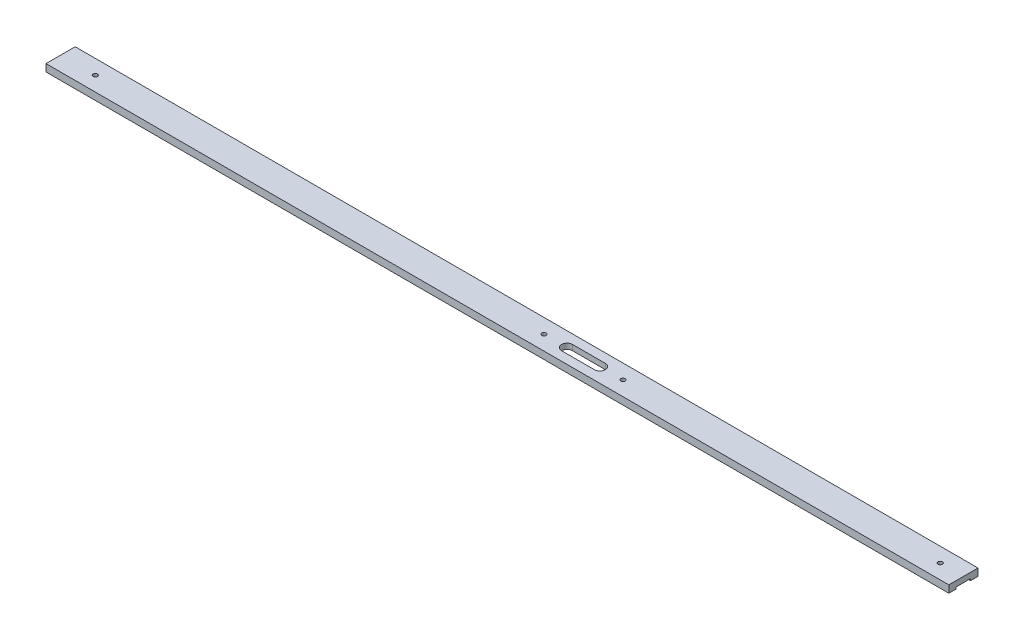
from build123d import *

# Parameters (mm, degrees)
SKETCH1_W                 = 247.65
SKETCH1_H                 = 8
BOSS_EXTRUDE1_DEPTH       = 2
SKETCH2_W                 = 4
SKETCH2_H                 = 1
CUT_EXTRUDE1_DEPTH        = 248.690376277
CUT_EXTRUDE2_DEPTH        = 124.898670796
F_0_80_TAPPED_HOLE1_D     = 1.19126
F_0_80_TAPPED_HOLE1_DEPTH = 4.572
F_0_80_TAPPED_HOLE1_TIP   = 0.357890611


with BuildPart() as part:
    # Sketch1 → Boss-Extrude1 (new body)
    with BuildSketch(Plane(origin=(0, 0, 0), x_dir=(1, 0, 0), z_dir=(0, 1, 0))):
        Rectangle(SKETCH1_W, SKETCH1_H)
    extrude(amount=BOSS_EXTRUDE1_DEPTH)

    # Sketch2 → Cut-Extrude1 (cut, through all)
    with BuildSketch(Plane(origin=(123.825, 0, 0), x_dir=(0, 0, -1), z_dir=(1, 0, 0))):
        Rectangle(SKETCH2_W, SKETCH2_H)
    extrude(amount=-CUT_EXTRUDE1_DEPTH, mode=Mode.SUBTRACT)

    # Sketch5 → Cut-Extrude2 (cut, through all)
    with BuildSketch(Plane(origin=(0, 0.5, 0), x_dir=(-1, 0, 0), z_dir=(0, 1, 0))):
        with BuildLine():
            Line((-15.1088, -1.5), (-24.1088, -1.5))
            ThreePointArc((-24.1088, -1.5), (-25.6088, 0), (-24.1088, 1.5))
            Line((-24.1088, 1.5), (-15.1088, 1.5))
            ThreePointArc((-15.1088, 1.5), (-13.6088, 0), (-15.1088, -1.5))
        make_face()
    extrude(amount=CUT_EXTRUDE2_DEPTH, mode=Mode.SUBTRACT)

    # #0-80 Tapped Hole1
    with Locations(Plane(origin=(0, 2, 0), x_dir=(-1, 0, 0), z_dir=(0, 1, 0))):
        with Locations((114.3, 0), (-8.7588, 0), (-30.4588, 0), (-117.475, 0)):
            Hole(F_0_80_TAPPED_HOLE1_D / 2, depth=F_0_80_TAPPED_HOLE1_DEPTH)
            with Locations((0, 0, -(F_0_80_TAPPED_HOLE1_DEPTH + F_0_80_TAPPED_HOLE1_TIP / 2))):  # 118° drill point
                Cone(0, F_0_80_TAPPED_HOLE1_D / 2, F_0_80_TAPPED_HOLE1_TIP, mode=Mode.SUBTRACT)


solid = part.part
